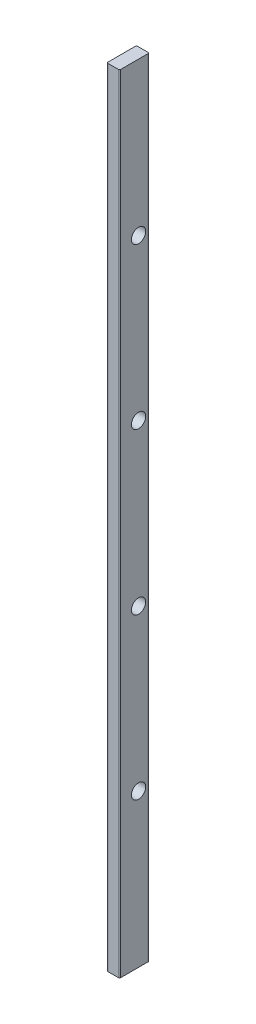
from build123d import *

# Parameters (mm, degrees)
SKETCH1_W           = 38.1
SKETCH1_H           = 88.9
BOSS_EXTRUDE1_DEPTH = 2362.2
SKETCH2_R           = 21.43125
CUT_EXTRUDE4_DEPTH  = 2363.925359062
FILLET1_R           = 3.175


with BuildPart() as part:
    # Sketch1 → Boss-Extrude1 (new body)
    with BuildSketch(Plane(origin=(0, 0, 0), x_dir=(1, 0, 0), z_dir=(0, 1, 0))):
        Rectangle(SKETCH1_W, SKETCH1_H)
    extrude(amount=BOSS_EXTRUDE1_DEPTH)

    # Sketch2 → Cut-Extrude4 (cut, through all)
    with BuildSketch(Plane(origin=(-19.05, 0, 0), x_dir=(0, 0, -1), z_dir=(1, 0, 0))):
        with Locations(Location((12.7, 458.7875, 0), (0, 0, 180))):
            Circle(SKETCH2_R)
        with Locations(Location((12.7, 939.8, 0), (0, 0, 180))):
            Circle(SKETCH2_R)
    cut_extrude4 = extrude(amount=CUT_EXTRUDE4_DEPTH, mode=Mode.SUBTRACT)

    # Fillet1
    fillet1_edges = [part.edges().sort_by_distance(p)[0] for p in [
        (19.05, 1181.1, 44.45),
        (-19.05, 1181.1, 44.45),
        (-19.05, 1181.1, -44.45),
        (19.05, 1181.1, -44.45),
    ]]
    fillet(fillet1_edges, radius=FILLET1_R)

    # Mirror1: Cut-Extrude4 across plane
    add(cut_extrude4.mirror(Plane(origin=(0, 1181.1, 0), x_dir=(0, 0, 1), z_dir=(0, -1, 0))), mode=Mode.SUBTRACT)


solid = part.part
